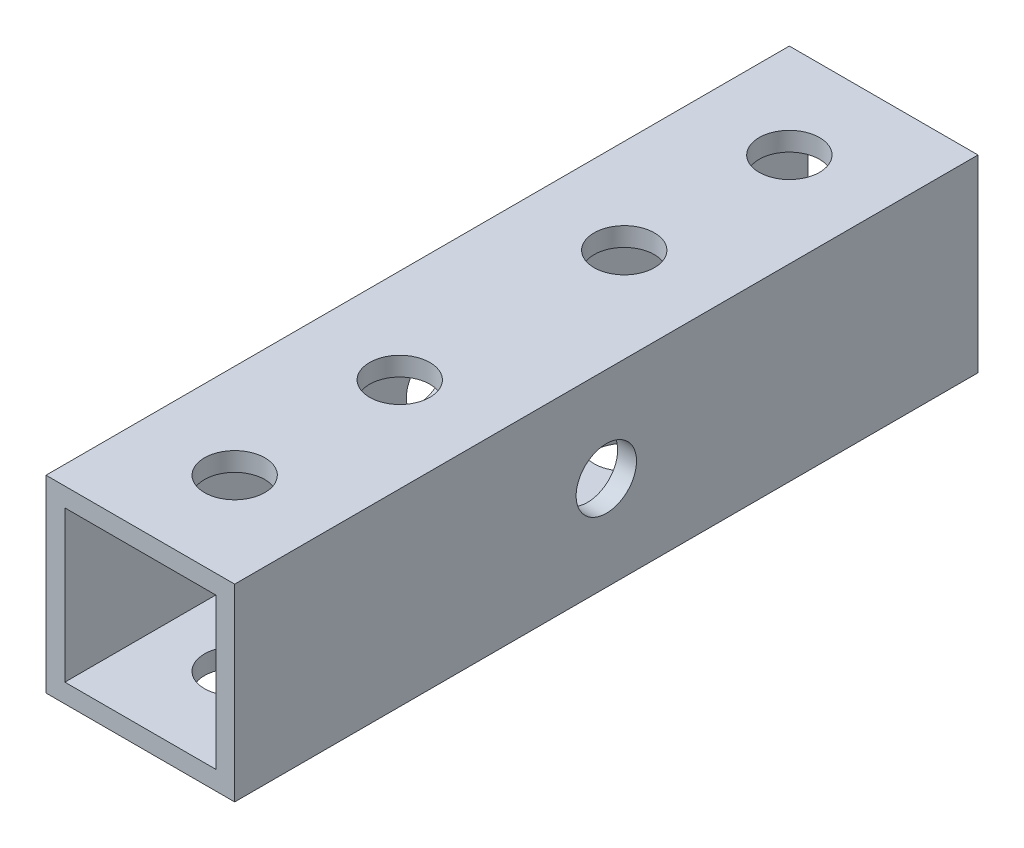
from build123d import *

# Parameters (mm, degrees)
SKETCH_1_W          = 10
SKETCH_1_H          = 10
SKETCH_1_W_2        = 8
SKETCH_1_H_2        = 8
EXTRUDE_1_DEPTH     = 39.4
SKETCH_2_R          = 1.6
CUT_EXTRUDE_1_DEPTH = 41.9555857
SKETCH_3_R          = 1.6
CUT_EXTRUDE_2_DEPTH = 41.9555857
SKETCH_4_R          = 1.6
CUT_EXTRUDE_3_DEPTH = 41.9555857


with BuildPart() as part:
    # ｽｹｯﾁ1 → 押し出し-薄板1 (new body)
    with BuildSketch(Plane.XY):
        Rectangle(SKETCH_1_W, SKETCH_1_H)
        Rectangle(SKETCH_1_W_2, SKETCH_1_H_2, mode=Mode.SUBTRACT)
    extrude(amount=EXTRUDE_1_DEPTH)

    # ｽｹｯﾁ2 → ｶｯﾄ - 押し出し1 (cut, through all)
    with BuildSketch(Plane(origin=(0, 5, 0), x_dir=(1, 0, 0), z_dir=(0, 1, 0))):
        with Locations(Location((0, -5, 0), (0, 0, 270))):
            Circle(SKETCH_2_R)
        with Locations(Location((0, -34.4, 0), (0, 0, 270))):
            Circle(SKETCH_2_R)
    extrude(amount=-CUT_EXTRUDE_1_DEPTH, mode=Mode.SUBTRACT)

    # ｽｹｯﾁ3 → ｶｯﾄ - 押し出し2 (cut, through all)
    with BuildSketch(Plane(origin=(0, 5, 0), x_dir=(1, 0, 0), z_dir=(0, 1, 0))):
        with Locations(Location((0, -13.75, 0), (0, 0, 270))):
            Circle(SKETCH_3_R)
        with Locations(Location((0, -25.65, 0), (0, 0, 270))):
            Circle(SKETCH_3_R)
    extrude(amount=-CUT_EXTRUDE_2_DEPTH, mode=Mode.SUBTRACT)

    # ｽｹｯﾁ4 → ｶｯﾄ - 押し出し3 (cut, through all)
    with BuildSketch(Plane(origin=(5, 0, 0), x_dir=(0, 0, -1), z_dir=(1, 0, 0))):
        with Locations((-19.7, 0)):
            Circle(SKETCH_4_R)
    extrude(amount=-CUT_EXTRUDE_3_DEPTH, mode=Mode.SUBTRACT)


solid = part.part
